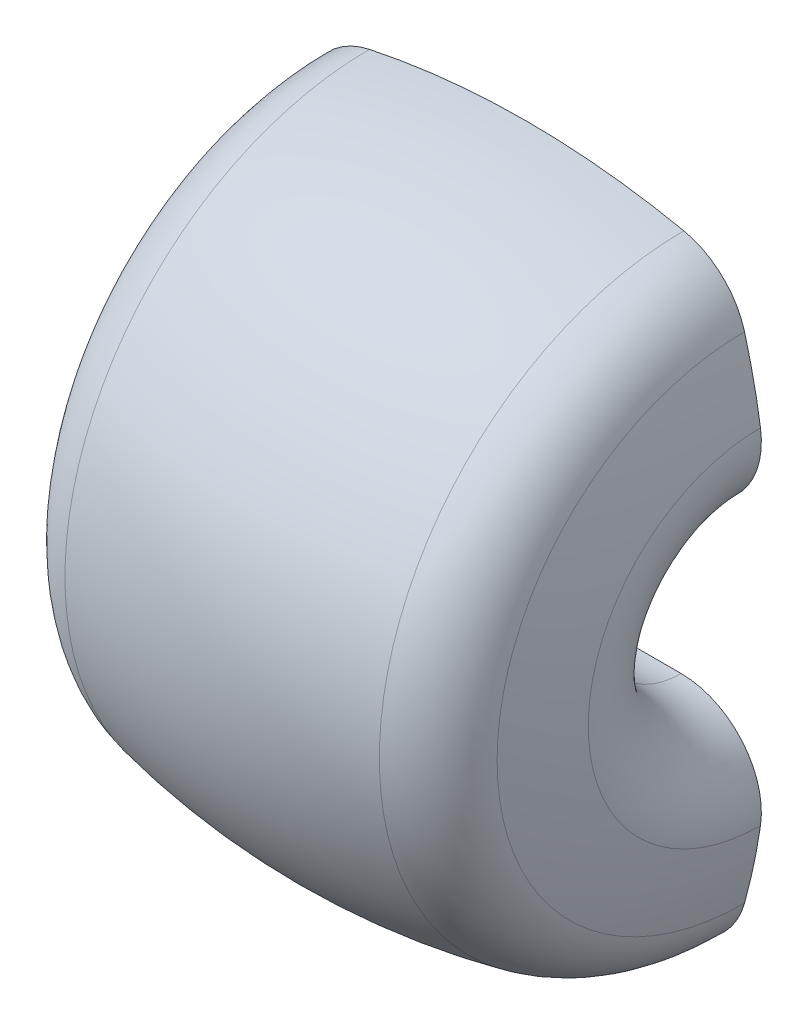
from build123d import *

# Parameters (mm, degrees)
REVOLVE_1_ANGLE     = 180
FILLET_1_R          = 5
FILLET_2_R          = 5
SKETCH_2_W          = 12
SKETCH_2_H          = 5
CUT_EXTRUDE_1_DEPTH = 6


with BuildPart() as part:
    # 草图1 → 旋转1 (revolve)
    with BuildSketch(Plane.XY):
        with BuildLine():
            Line((-15, 5), (15, 5))
            ThreePointArc((15, 5), (14.412847263, 11.739422714), (12.669081334, 18.275770872))
            ThreePointArc((12.669081334, 18.275770872), (0, 20), (-12.669081334, 18.275770872))
            ThreePointArc((-12.669081334, 18.275770872), (-14.412847263, 11.739422714), (-15, 5))
        make_face()
    revolve(axis=Axis((-17.5, 0, 0), (1, 0, 0)), revolution_arc=REVOLVE_1_ANGLE)

    # 圆角1
    fillet_1_edges = [part.edges().sort_by_distance(p)[0] for p in [
        (12.669081334, 0, 18.275770872),
        (-12.669081334, 0, 18.275770872),
    ]]
    fillet(fillet_1_edges, radius=FILLET_1_R)

    # 圆角2
    fillet_2_edges = [part.edges().sort_by_distance(p)[0] for p in [
        (-15, 0, 5),
        (15, 0, 5),
    ]]
    fillet(fillet_2_edges, radius=FILLET_2_R)

    # 草图2 → 切除-拉伸1 (cut)
    with BuildSketch(Plane(origin=(0, 0, 0), x_dir=(-1, 0, 0), z_dir=(0, 0, -1))):
        with Locations((0, 12)):
            Rectangle(SKETCH_2_W, SKETCH_2_H)
        with Locations((0, -12)):
            Rectangle(SKETCH_2_W, SKETCH_2_H)
    extrude(amount=-CUT_EXTRUDE_1_DEPTH, mode=Mode.SUBTRACT)


solid = part.part
